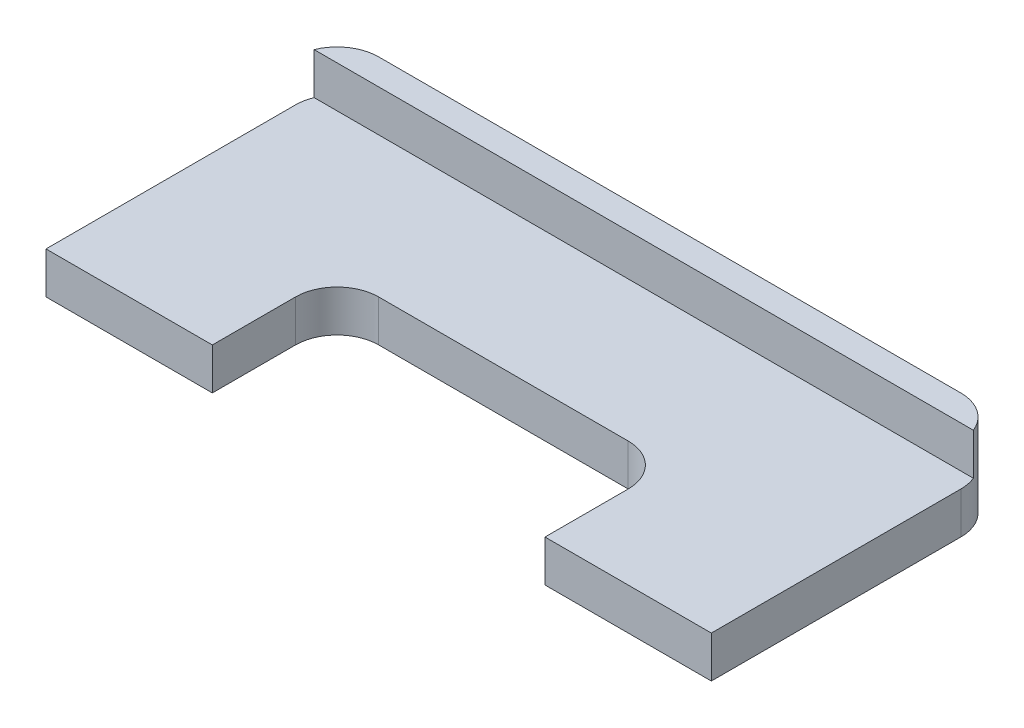
from build123d import *

# Parameters (mm, degrees)
SKETCH1_W           = 20.32
SKETCH1_H           = 10.16
BOSS_EXTRUDE1_DEPTH = 1.27
SKETCH2_W           = 10.16
SKETCH2_H           = 5.08
CUT_EXTRUDE1_DEPTH  = 12.43
SKETCH4_W           = 20.32
SKETCH4_H           = 0.79375
BOSS_EXTRUDE2_DEPTH = 1.27
SKETCH5_W           = 5.08
SKETCH5_H           = 1.27
CUT_EXTRUDE2_DEPTH  = 1.27
FILLET1_R           = 1.27


with BuildPart() as part:
    # Sketch1 → Boss-Extrude1 (new body)
    with BuildSketch(Plane(origin=(0, 0, 0), x_dir=(1, 0, 0), z_dir=(0, 1, 0))):
        Rectangle(SKETCH1_W, SKETCH1_H)
    extrude(amount=BOSS_EXTRUDE1_DEPTH)

    # Sketch2 → Cut-Extrude1 (cut, through all)
    with BuildSketch(Plane(origin=(0, 1.27, 0), x_dir=(1, 0, 0), z_dir=(0, 1, 0))):
        with Locations((0, -2.54)):
            Rectangle(SKETCH2_W, SKETCH2_H)
    extrude(amount=-CUT_EXTRUDE1_DEPTH, mode=Mode.SUBTRACT)

    # Sketch4 → Boss-Extrude2 (add)
    with BuildSketch(Plane(origin=(0, 1.27, 0), x_dir=(1, 0, 0), z_dir=(0, 1, 0))):
        with Locations((0, 4.683125)):
            Rectangle(SKETCH4_W, SKETCH4_H)
    extrude(amount=BOSS_EXTRUDE2_DEPTH)

    # Sketch5 → Cut-Extrude2 (cut)
    with BuildSketch(Plane.XY.offset(5.08)):
        with Locations((7.62, 0.635)):
            Rectangle(SKETCH5_W, SKETCH5_H)
        with Locations((-7.62, 0.635)):
            Rectangle(SKETCH5_W, SKETCH5_H)
    extrude(amount=-CUT_EXTRUDE2_DEPTH, mode=Mode.SUBTRACT)

    # Fillet1
    fillet1_edges = [part.edges().sort_by_distance(p)[0] for p in [
        (10.16, 1.27, -5.08),
        (5.08, 0.635, 0),
        (-5.08, 0.635, 0),
        (-10.16, 1.27, -5.08),
    ]]
    fillet(fillet1_edges, radius=FILLET1_R)


solid = part.part
